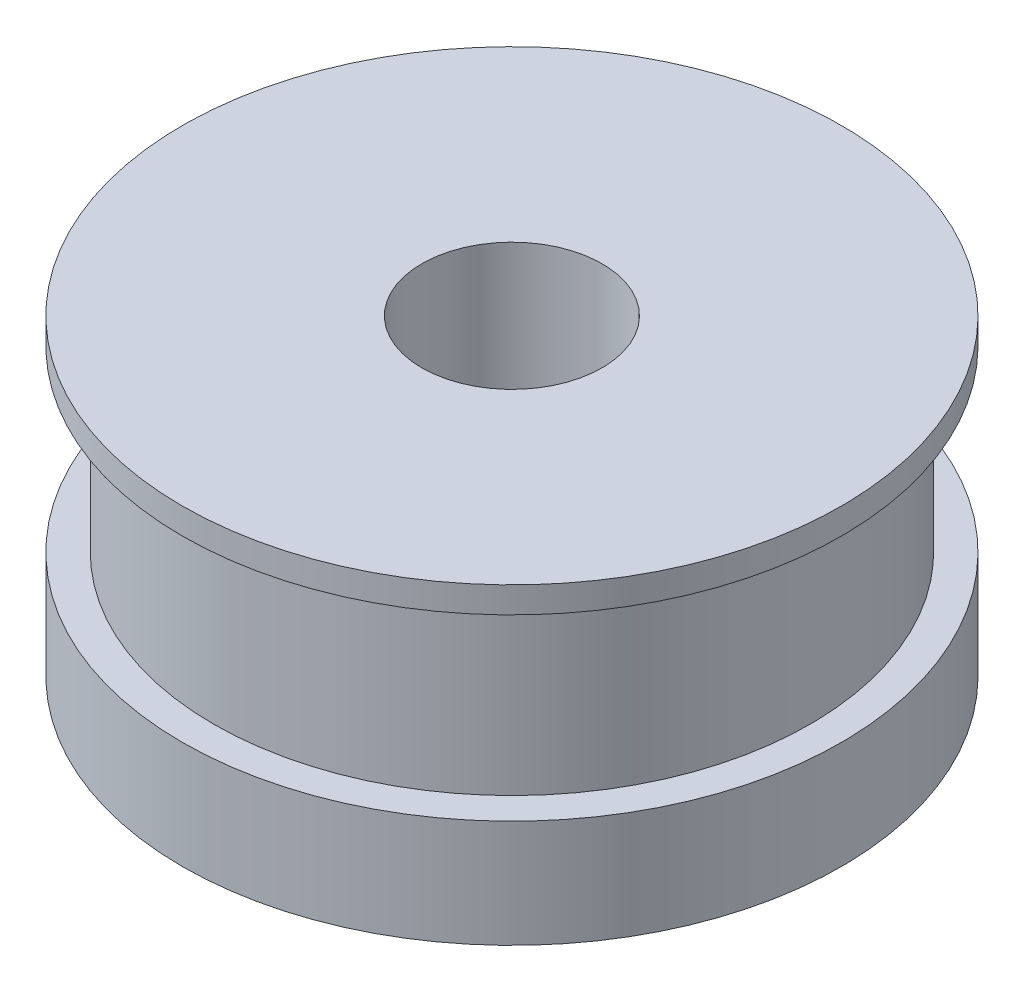
from build123d import *

# Parameters (mm, degrees)
M3_TAPPED_HOLE1_D     = 2.5
M3_TAPPED_HOLE1_DEPTH = 4
M3_TAPPED_HOLE1_TIP   = 0.751075774


with BuildPart() as part:
    # Sketch1 → Revolve1 (revolve)
    with BuildSketch(Plane(origin=(0, 0, 0), x_dir=(0, 0, -1), z_dir=(1, 0, 0)), mode=Mode.PRIVATE) as revolve1_sk:
        Polygon((17.19, -5.15), (17.19, 5.15), (19, 5.15), (19, 6.65), (10.28, 6.65), (5.2, 6.65), (5.2, -6.65), (5.2, -11.35), (19, -11.35), (19, -5.15), align=None)
    revolve(revolve1_sk.sketch.rotate(Axis((0, 10.31552251, 0), (0, -1, 0)), 180), axis=Axis((0, 10.31552251, 0), (0, -1, 0)))

    # M3 Tapped Hole1
    with Locations(Plane(origin=(0, -11.35, 0), x_dir=(-1, 0, 0), z_dir=(0, -1, 0))):
        with Locations((0, -8), (-8, 0), (0, 8), (8, 0)):
            Hole(M3_TAPPED_HOLE1_D / 2, depth=M3_TAPPED_HOLE1_DEPTH)
            with Locations((0, 0, -(M3_TAPPED_HOLE1_DEPTH + M3_TAPPED_HOLE1_TIP / 2))):  # 118° drill point
                Cone(0, M3_TAPPED_HOLE1_D / 2, M3_TAPPED_HOLE1_TIP, mode=Mode.SUBTRACT)


solid = part.part
